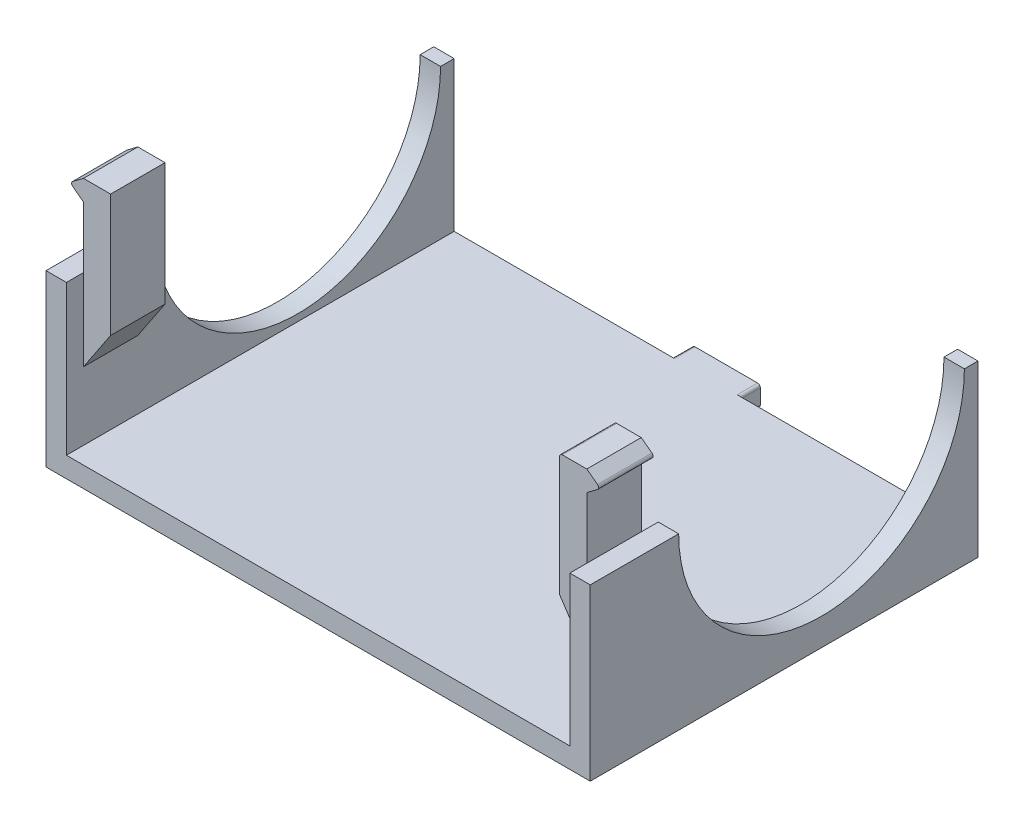
from build123d import *

# Parameters (mm, degrees)
EXTRUDE_1_DEPTH        = 28.5
SKETCH_2_R             = 10.5
CUT_EXTRUDE_1_DEPTH    = 87
SKETCH_3_W             = 5
SKETCH_3_H             = 1.5
EXTRUDE_2_DEPTH        = 1.5
FILLET_1_R             = 0.2
EXTRUDE_START          = -3
SKETCH_4_W             = 2
SKETCH_4_H             = 4
EXTRUDE_3_DEPTH        = 9
EXTRUDE_4_DEPTH        = 4
FILLET_2_R             = 0.2
FILLET_1_OF_MIRROR_1_R = 0.2
FILLET_2_OF_MIRROR_1_R = 0.2
FILLET_3_R             = 0.2


with BuildPart() as part:
    # 草图1 → 凸台-拉伸1 (new body)
    with BuildSketch(Plane.XY):
        Polygon((0, 0), (40, 0), (40, 12.5), (38.5, 12.5), (38.5, 1.5), (1.5, 1.5), (1.5, 12.5), (0, 12.5), align=None)
    extrude(amount=EXTRUDE_1_DEPTH)

    # 草图2 → 切除-拉伸1 (cut)
    with BuildSketch(Plane(origin=(40, 0, 0), x_dir=(0, 0, -1), z_dir=(1, 0, 0))):
        with Locations((-11.5, 12.5)):
            Circle(SKETCH_2_R)
    extrude(amount=-CUT_EXTRUDE_1_DEPTH, mode=Mode.SUBTRACT)

    # 草图3 → 凸台-拉伸2 (add)
    with BuildSketch(Plane(origin=(0, 0, 0), x_dir=(-1, 0, 0), z_dir=(0, 0, -1))):
        with Locations((-20, 0.75)):
            Rectangle(SKETCH_3_W, SKETCH_3_H)
    extrude_2 = extrude(amount=EXTRUDE_2_DEPTH)

    # 圆角1
    fillet_1_edges = [part.edges().sort_by_distance(p)[0] for p in [
        (17.5, 0, -0.75),
        (17.5, 1.5, -0.75),
        (22.5, 1.5, -0.75),
        (22.5, 0, -0.75),
    ]]
    fillet(fillet_1_edges, radius=FILLET_1_R)

    # 草图4 → 凸台-拉伸3 (add)
    with BuildSketch(Plane(origin=(0, 12.5, 0), x_dir=(1, 0, 0), z_dir=(0, 1, 0)).offset(EXTRUDE_START)):
        with Locations((37.5, -25.25)):
            Rectangle(SKETCH_4_W, SKETCH_4_H)
    extrude_3 = extrude(amount=EXTRUDE_3_DEPTH)

    # 草图5 → 凸台-拉伸4 (add)
    with BuildSketch(Plane.XY.offset(27.25)):
        Polygon((36.5, 9.5), (38.5, 6.5), (38.5, 9.5), align=None)
        Polygon((38.5, 18.5), (39.5, 17.75), (38.5, 17), align=None)
    extrude_4 = extrude(amount=-EXTRUDE_4_DEPTH)

    # 圆角2
    fillet_2_edges = [part.edges().sort_by_distance(p)[0] for p in [
        (39.5, 17.75, 25.25),
    ]]
    fillet(fillet_2_edges, radius=FILLET_2_R)

    # 镜向1: 凸台-拉伸2, 凸台-拉伸3, 凸台-拉伸4 across plane
    add(extrude_2.mirror(Plane(origin=(20, 0, 0), x_dir=(0, 0, 1), z_dir=(1, 0, 0))))
    add(extrude_3.mirror(Plane(origin=(20, 0, 0), x_dir=(0, 0, 1), z_dir=(1, 0, 0))))
    add(extrude_4.mirror(Plane(origin=(20, 0, 0), x_dir=(0, 0, 1), z_dir=(1, 0, 0))))

    # 圆角1 of 镜向1
    fillet_1_of_mirror_1_edges = [part.edges().sort_by_distance(p)[0] for p in [
        (22.5, 0, -0.75),
        (22.5, 1.5, -0.75),
        (17.5, 1.5, -0.75),
        (17.5, 0, -0.75),
    ]]
    fillet(fillet_1_of_mirror_1_edges, radius=FILLET_1_OF_MIRROR_1_R)

    # 圆角2 of 镜向1
    fillet_2_of_mirror_1_edges = [part.edges().sort_by_distance(p)[0] for p in [
        (0.5, 17.75, 25.25),
    ]]
    fillet(fillet_2_of_mirror_1_edges, radius=FILLET_2_OF_MIRROR_1_R)

    # 圆角3
    fillet_3_edges = [part.edges().sort_by_distance(p)[0] for p in [
        (36.5, 18.5, 25.25),
    ]]
    fillet(fillet_3_edges, radius=FILLET_3_R)


solid = part.part
